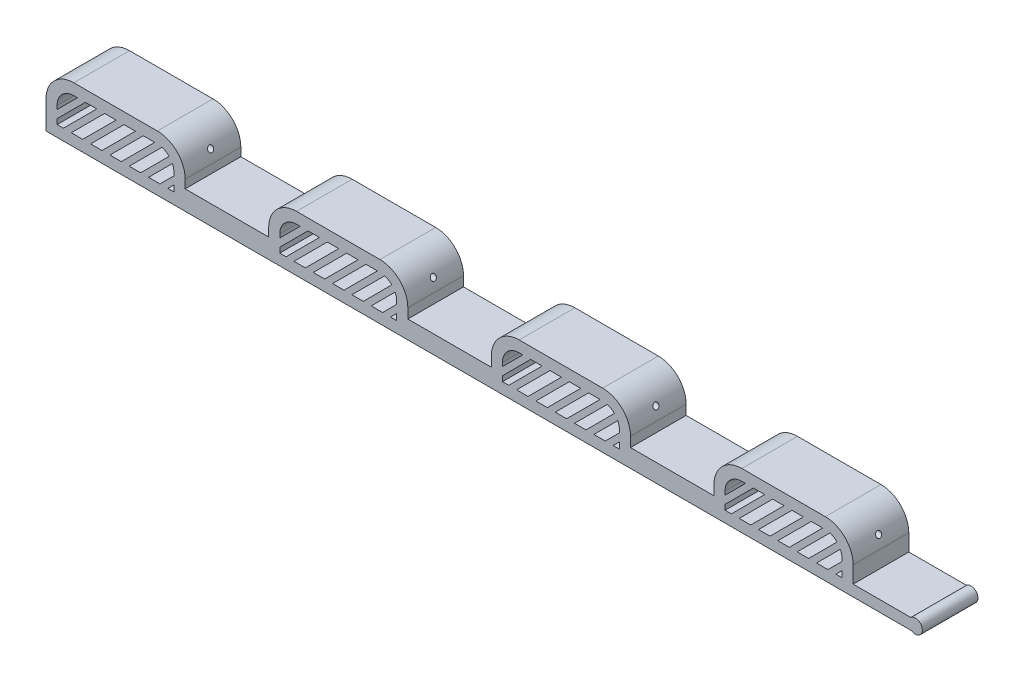
from build123d import *

# Parameters (mm, degrees)
SKETCH1_W               = 15
SKETCH1_H               = 2
BOSS_EXTRUDE1_DEPTH     = 10
FILLET1_R               = 5
CUT_EXTRUDE1_DEPTH      = 10
LPATTERN1_COUNT         = 4
LPATTERN1_PITCH         = 40
CUT_EXTRUDE2_DEPTH      = 159.064672857
CUT_EXTRUDE2_DEPTH_BACK = 159.064672857
SKETCH7_W               = 15
SKETCH7_H               = 1.5
SKETCH7_H_2             = 1.25
BOSS_EXTRUDE2_DEPTH     = 10


with BuildPart() as part:
    # Sketch1 → Boss-Extrude1 (new body)
    with BuildSketch(Plane.XY):
        Polygon((0, 10), (0, 0), (25, 0), (25, 2), (25, 10), align=None)
        with Locations((32.5, 1)):
            Rectangle(SKETCH1_W, SKETCH1_H)
        Polygon((40, 2), (40, 0), (65, 0), (65, 2), (65, 10), (40, 10), align=None)
        with Locations((72.5, 1)):
            Rectangle(SKETCH1_W, SKETCH1_H)
        Polygon((80, 2), (80, 0), (105, 0), (105, 2), (105, 10), (80, 10), align=None)
        with Locations((112.5, 1)):
            Rectangle(SKETCH1_W, SKETCH1_H)
        Polygon((120, 2), (120, 0), (145, 0), (145, 2), (145, 10), (120, 10), align=None)
        with BuildLine():
            Line((145, 2), (145, 0))
            Line((145, 0), (155.511735809, 0))
            ThreePointArc((155.511735809, 0), (154.93426114, 0.962263687), (155.361498474, 2))
            Line((155.361498474, 2), (145, 2))
        make_face()
        with BuildLine():
            ThreePointArc((155.361498474, 2), (154.93426114, 0.962263687), (155.511735809, 0))
            ThreePointArc((155.511735809, 0), (156.783340813, -0.039265426), (157.430749237, 1.055898211))
            ThreePointArc((157.430749237, 1.055898211), (157.317974688, 1.574760691), (157, 2))
            Line((157, 2), (155.361498474, 2))
        make_face()
        with BuildLine():
            ThreePointArc((157, 2), (156.180749237, 2.305898211), (155.361498474, 2))
            Line((155.361498474, 2), (157, 2))
        make_face()
    extrude(amount=BOSS_EXTRUDE1_DEPTH)

    # Fillet1
    fillet1_edges = [part.edges().sort_by_distance(p)[0] for p in [
        (40, 10, 5),
        (65, 10, 5),
        (80, 10, 5),
        (105, 10, 5),
        (120, 10, 5),
        (145, 10, 5),
        (0, 10, 5),
        (25, 10, 5),
    ]]
    fillet(fillet1_edges, radius=FILLET1_R)

    # Sketch4 → Cut-Extrude1 (cut)
    with BuildSketch(Plane.XY.offset(10)):
        with BuildLine():
            Line((2, 4.343540535), (5.656459465, 8))
            Line((5.656459465, 8), (5, 8))
            ThreePointArc((5, 8), (2.878679656, 7.121320344), (2, 5))
            Line((2, 5), (2, 4.343540535))
        make_face()
        Polygon((2, 2), (3.125488568, 2), (9.125488568, 8), (7.070673027, 8), (2, 2.929326973), align=None)
        Polygon((4.539702131, 2), (6.594517672, 2), (12.594517672, 8), (10.539702131, 8), align=None)
        Polygon((8.008731234, 2), (10.063546775, 2), (16.063546775, 8), (14.008731234, 8), align=None)
        Polygon((11.477760338, 2), (13.532575879, 2), (19.532575879, 8), (17.477760338, 8), align=None)
        with BuildLine():
            Line((17.001604982, 2), (22.122122683, 7.120517701))
            ThreePointArc((22.122122683, 7.120517701), (21.524378958, 7.583847672), (20.829757185, 7.882967744))
            Line((20.829757185, 7.882967744), (14.946789441, 2))
            Line((14.946789441, 2), (17.001604982, 2))
        make_face()
        with BuildLine():
            Line((23, 4.529365914), (23, 5))
            ThreePointArc((23, 5), (22.925993515, 5.662240099), (22.707625368, 6.291806823))
            Line((22.707625368, 6.291806823), (18.415818545, 2))
            Line((18.415818545, 2), (20.470634086, 2))
            Line((20.470634086, 2), (23, 4.529365914))
        make_face()
        Polygon((23, 2), (23, 3.115152352), (21.884847648, 2), align=None)
    cut_extrude1 = extrude(amount=-CUT_EXTRUDE1_DEPTH, mode=Mode.SUBTRACT)

    # LPattern1: Cut-Extrude1 ×4
    with Locations(*[(i * LPATTERN1_PITCH, 0, 0) for i in range(1, LPATTERN1_COUNT)]):
        add(cut_extrude1, mode=Mode.SUBTRACT)

    # Sketch5 → Cut-Extrude2 (cut, two sides: drawn at the far end of the back side and taken through both)
    with BuildSketch(Plane(origin=(0, 0, 0), x_dir=(0, 0, -1), z_dir=(1, 0, 0)).offset(-CUT_EXTRUDE2_DEPTH_BACK)):
        with BuildLine():
            ThreePointArc((-4.5, 7), (-4.646446609, 7.353553391), (-5, 7.5))
            Line((-5, 7.5), (-5, 6.5))
            ThreePointArc((-5, 6.5), (-4.646446609, 6.646446609), (-4.5, 7))
        make_face()
        with BuildLine():
            Line((-5, 6.5), (-5, 7.5))
            ThreePointArc((-5, 7.5), (-5.5, 7), (-5, 6.5))
        make_face()
    extrude(amount=CUT_EXTRUDE2_DEPTH + CUT_EXTRUDE2_DEPTH_BACK, mode=Mode.SUBTRACT)

    # Sketch7 → Boss-Extrude2 (add)
    with BuildSketch(Plane.XY):
        with Locations((32.5, 2.75)):
            Rectangle(SKETCH7_W, SKETCH7_H)
        with Locations((72.5, 2.625)):
            Rectangle(SKETCH7_W, SKETCH7_H_2)
        with Locations((112.5, 2.625)):
            Rectangle(SKETCH7_W, SKETCH7_H_2)
    extrude(amount=BOSS_EXTRUDE2_DEPTH)


solid = part.part
